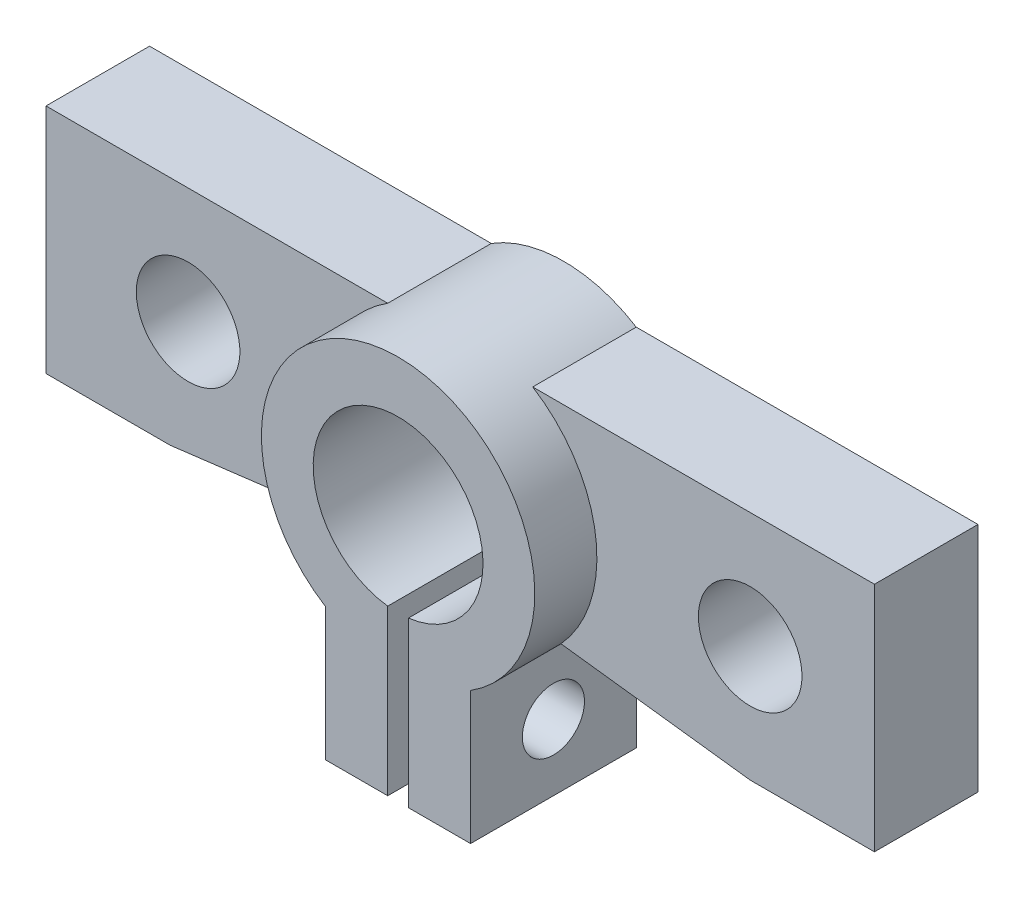
from build123d import *

# Parameters (mm, degrees)
BOSS_EXTRUDE1_DEPTH = 8
CUT_EXTRUDE1_DEPTH  = 8
SKETCH4_R           = 2.5
BOSS_EXTRUDE2_DEPTH = 5


with BuildPart() as part:
    # Sketch1 → Boss-Extrude1 (new body)
    with BuildSketch(Plane(origin=(0, 0, 0), x_dir=(0, 1, 0), z_dir=(0, 0, 1))):
        with BuildLine():
            Line((-12, 3.5), (-5.595533933, 3.5))
            ThreePointArc((-5.595533933, 3.5), (6.6, 0), (-5.595533933, -3.5))
            Line((-5.595533933, -3.5), (-12, -3.5))
            Line((-12, -3.5), (-12, -0.5))
            Line((-12, -0.5), (-4.06939799, -0.5))
            ThreePointArc((-4.06939799, -0.5), (4.1, 0), (-4.06939799, 0.5))
            Line((-4.06939799, 0.5), (-12, 0.5))
            Line((-12, 0.5), (-12, 3.5))
        make_face()
    extrude(amount=BOSS_EXTRUDE1_DEPTH)

    # Sketch2 → Cut-Extrude1 (cut)
    with BuildSketch(Plane(origin=(-3.5, 0, 0), x_dir=(0, -1, 0), z_dir=(-1, 0, 0))):
        with BuildLine():
            ThreePointArc((10.297766967, 4), (9.858427138, 5.060660172), (8.797766967, 5.5))
            Line((8.797766967, 5.5), (8.797766967, 2.5))
            ThreePointArc((8.797766967, 2.5), (9.858427138, 2.939339828), (10.297766967, 4))
        make_face()
        with BuildLine():
            Line((8.797766967, 2.5), (8.797766967, 5.5))
            ThreePointArc((8.797766967, 5.5), (7.297766967, 4), (8.797766967, 2.5))
        make_face()
    extrude(amount=-CUT_EXTRUDE1_DEPTH, mode=Mode.SUBTRACT)

    # Sketch4 → Boss-Extrude2 (add)
    # profile 1 of 2: a face of its own
    with BuildSketch(Plane(origin=(0, 0, 0), x_dir=(1, 0, 0), z_dir=(0, 0, -1))):
        with BuildLine():
            Line((20, 5.595533933), (14, 5.595533933))
            Line((14, 5.595533933), (4.863001587, 4.462198513))
            ThreePointArc((4.863001587, 4.462198513), (6.540217456, -0.886315759), (3.5, -5.595533933))
            Line((3.5, -5.595533933), (20, -5.595533933))
            Line((20, -5.595533933), (20, 5.595533933))
        make_face()
        with Locations(Location((14, 0, 0), (0, 0, 180))):
            Circle(SKETCH4_R, mode=Mode.SUBTRACT)
    # profile 2 of 2: a face of its own
    with BuildSketch(Plane(origin=(0, 0, 0), x_dir=(1, 0, 0), z_dir=(0, 0, -1))):
        with BuildLine():
            Line((-20, -5.595533933), (-3.5, -5.595533933))
            ThreePointArc((-3.5, -5.595533933), (-6.540217456, -0.886315759), (-4.863001587, 4.462198513))
            Line((-4.863001587, 4.462198513), (-14, 5.595533933))
            Line((-14, 5.595533933), (-20, 5.595533933))
            Line((-20, 5.595533933), (-20, -5.595533933))
        make_face()
        with Locations(Location((-13.139356118, 0, 0), (0, 0, 180))):
            Circle(SKETCH4_R, mode=Mode.SUBTRACT)
    extrude(amount=-BOSS_EXTRUDE2_DEPTH)


solid = part.part
